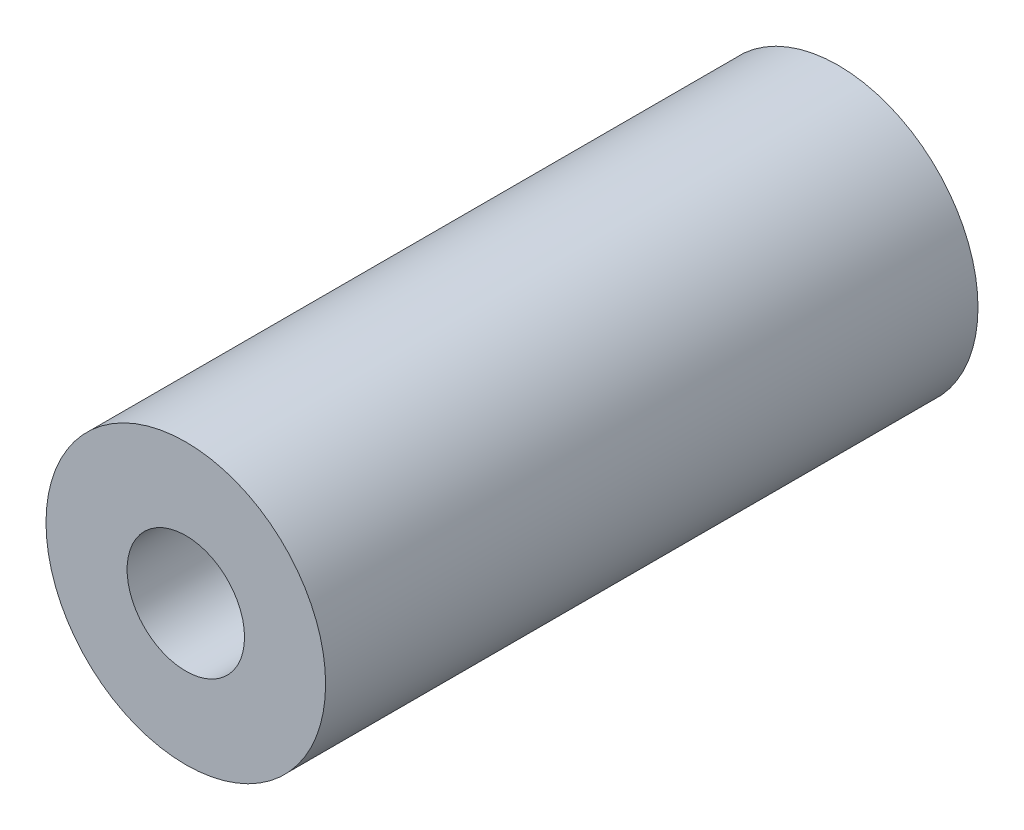
from build123d import *

# Parameters (mm, degrees)
SKETCH1_R      = 9.525
SKETCH1_R_2    = 4.0005
EXTRUDE1_DEPTH = 22.225


with BuildPart() as part:
    # Sketch1 → Extrude1 (new, symmetric)
    with BuildSketch(Plane.XY):
        Circle(SKETCH1_R)
        Circle(SKETCH1_R_2, mode=Mode.SUBTRACT)
    extrude(amount=EXTRUDE1_DEPTH, both=True)


solid = part.part
